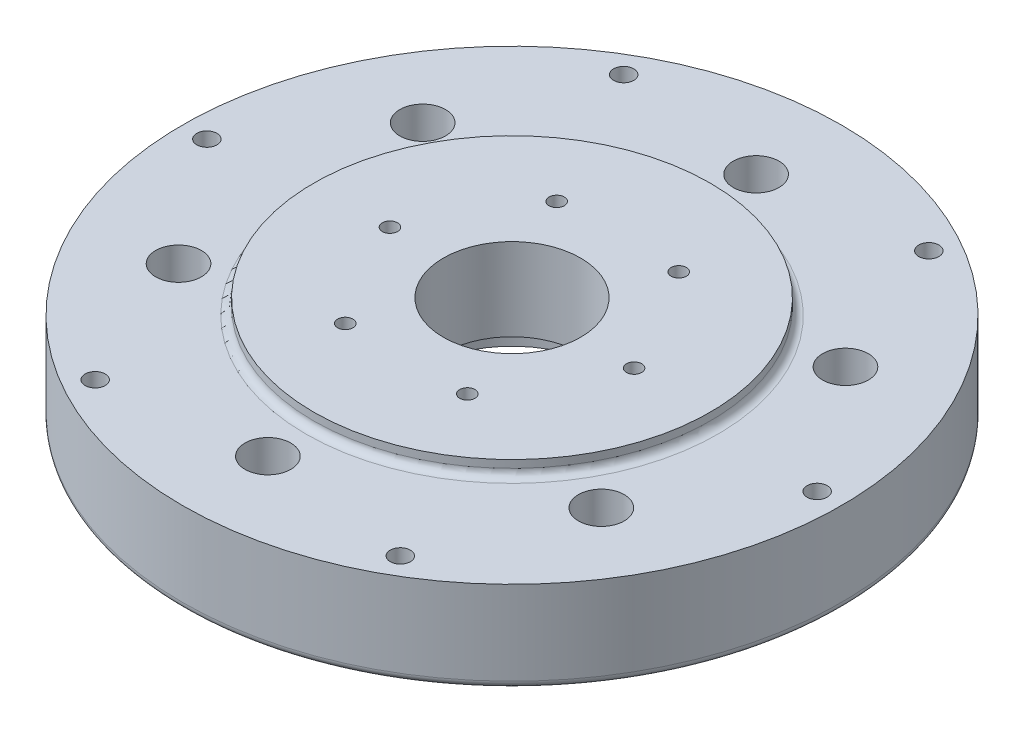
from build123d import *

# Parameters (mm, degrees)
SKETCH_1_R                = 108
SKETCH_1_R_2              = 22.5
EXTRUDE_1_DEPTH           = 30
SKETCH_2_R                = 65
SKETCH_2_R_2              = 22.5
EXTRUDE_2_DEPTH           = 5
SKETCH_6_R                = 30
CUT_EXTRUDE_2_DEPTH       = 8
FILLET_1_R                = 2.5
SKETCH_3_R                = 7.5
CUT_EXTRUDE_1_DEPTH       = 156.653461253
HOLE_WIZARD_M6_1_D        = 5
HOLE_WIZARD_2_D           = 6.6
HOLE_WIZARD_2_CBORE_D     = 11
HOLE_WIZARD_2_CBORE_DEPTH = 7
PATTERN_CIRCULAR_1_COUNT  = 6


with BuildPart() as part:
    # 草图1 → 凸台-拉伸1 (new body)
    with BuildSketch(Plane(origin=(0, 0, 0), x_dir=(1, 0, 0), z_dir=(0, 1, 0))):
        with Locations(Location((0, 0, 0), (0, 0, 270))):
            Circle(SKETCH_1_R)
        with Locations(Location((0, 0, 0), (0, 0, 270))):
            Circle(SKETCH_1_R_2, mode=Mode.SUBTRACT)
    extrude(amount=EXTRUDE_1_DEPTH)

    # 草图2 → 凸台-拉伸2 (add)
    with BuildSketch(Plane(origin=(0, 30, 0), x_dir=(1, 0, 0), z_dir=(0, 1, 0))):
        with Locations(Location((0, 0, 0), (0, 0, 270))):
            Circle(SKETCH_2_R)
        with Locations(Location((0, 0, 0), (0, 0, 270))):
            Circle(SKETCH_2_R_2, mode=Mode.SUBTRACT)
    extrude(amount=EXTRUDE_2_DEPTH)

    # 草图6 → 切除-拉伸2 (cut)
    with BuildSketch(Plane.XZ):
        with Locations(Location((0, 0, 0), (0, 0, 270))):
            Circle(SKETCH_6_R)
    extrude(amount=-CUT_EXTRUDE_2_DEPTH, mode=Mode.SUBTRACT)

    # 圆角1
    fillet_1_edges = [part.edges().sort_by_distance(p)[0] for p in [
        (0, 30, -65),
        (0, 0, -108),
    ]]
    fillet(fillet_1_edges, radius=FILLET_1_R)

    # 草图3 → 切除-拉伸1 (cut, through all)
    with BuildSketch(Plane(origin=(0, 30, 0), x_dir=(1, 0, 0), z_dir=(0, 1, 0))):
        with Locations(Location((0, 80, 0), (0, 0, 270))):
            Circle(SKETCH_3_R)
    cut_extrude_1 = extrude(amount=-CUT_EXTRUDE_1_DEPTH, mode=Mode.SUBTRACT)

    # M6 螺纹孔1 (through all)
    with Locations(Plane(origin=(0, 0, 0), x_dir=(-1, 0, 0), z_dir=(0, -1, 0))):
        with Locations((40, 0)):
            hole_wizard_m6_1 = Hole(HOLE_WIZARD_M6_1_D / 2)

    # 打孔尺寸(%根据)内六角圆柱头螺钉的类型2 (through all)
    with Locations(Plane(origin=(0, 0, 0), x_dir=(-1, 0, 0), z_dir=(0, -1, 0))):
        with Locations((100, 0)):
            hole_wizard_2 = CounterBoreHole(HOLE_WIZARD_2_D / 2, HOLE_WIZARD_2_CBORE_D / 2, HOLE_WIZARD_2_CBORE_DEPTH)

    # 草图11 → M3 螺纹孔1 (revolve, cut)
    with BuildSketch(Plane(origin=(0, 8, -25), x_dir=(0, 0, -1), z_dir=(1, 0, 0))):
        Polygon((0, 0), (0, 8.251075774), (1.25, 7.5), (1.25, 0), align=None)
    hole_wizard_m3_1 = revolve(axis=Axis((0, 1.65, -25), (0, 1, 0)), mode=Mode.SUBTRACT)

    # 阵列(圆周)1: 切除-拉伸1, M6 螺纹孔1, 打孔尺寸(%根据)内六角圆柱头螺钉的类型2, M3 螺纹孔1 ×6 about axis
    pattern_circular_1_axis = Axis((0, 0, 0), (0, 1, 0))
    add([cut_extrude_1.rotate(pattern_circular_1_axis, i * 360 / PATTERN_CIRCULAR_1_COUNT) for i in range(1, PATTERN_CIRCULAR_1_COUNT)], mode=Mode.SUBTRACT)
    add([hole_wizard_m6_1.rotate(pattern_circular_1_axis, i * 360 / PATTERN_CIRCULAR_1_COUNT) for i in range(1, PATTERN_CIRCULAR_1_COUNT)], mode=Mode.SUBTRACT)
    add([hole_wizard_2.rotate(pattern_circular_1_axis, i * 360 / PATTERN_CIRCULAR_1_COUNT) for i in range(1, PATTERN_CIRCULAR_1_COUNT)], mode=Mode.SUBTRACT)
    add([hole_wizard_m3_1.rotate(pattern_circular_1_axis, i * 360 / PATTERN_CIRCULAR_1_COUNT) for i in range(1, PATTERN_CIRCULAR_1_COUNT)], mode=Mode.SUBTRACT)


solid = part.part
